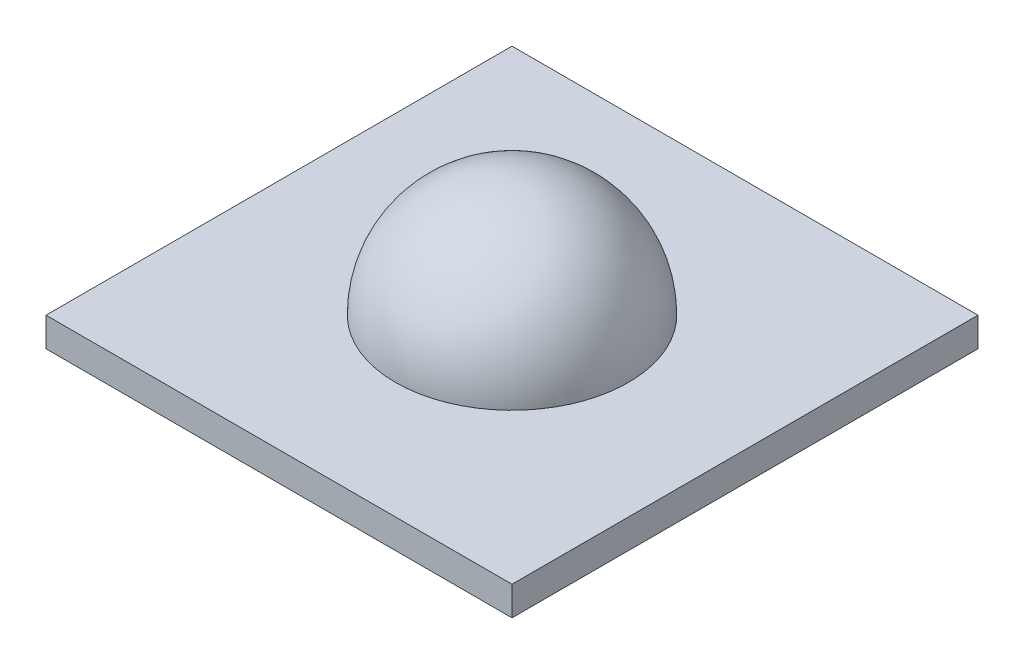
from build123d import *

# Parameters (mm, degrees)
ESQUISSE1_W        = 80
ESQUISSE1_H        = 80
BOSS_EXTRU_1_DEPTH = 5


with BuildPart() as part:
    # Esquisse1 → Boss.-Extru.1 (new body)
    with BuildSketch(Plane(origin=(0, 0, 0), x_dir=(1, 0, 0), z_dir=(0, 1, 0))):
        Rectangle(ESQUISSE1_W, ESQUISSE1_H)
    extrude(amount=BOSS_EXTRU_1_DEPTH)

    # Esquisse2 → Révolution2 (revolve)
    with BuildSketch(Plane(origin=(0, 0, 0), x_dir=(0, 0, -1), z_dir=(1, 0, 0)), mode=Mode.PRIVATE) as r_volution2_sk:
        with BuildLine():
            Line((-20, 5), (0, 5))
            Line((0, 5), (0, 25))
            ThreePointArc((0, 25), (-14.142135624, 19.142135624), (-20, 5))
        make_face()
    revolve(r_volution2_sk.sketch.rotate(Axis((0, 5, 0), (0, 1, 0)), 180), axis=Axis((0, 5, 0), (0, 1, 0)))


solid = part.part
